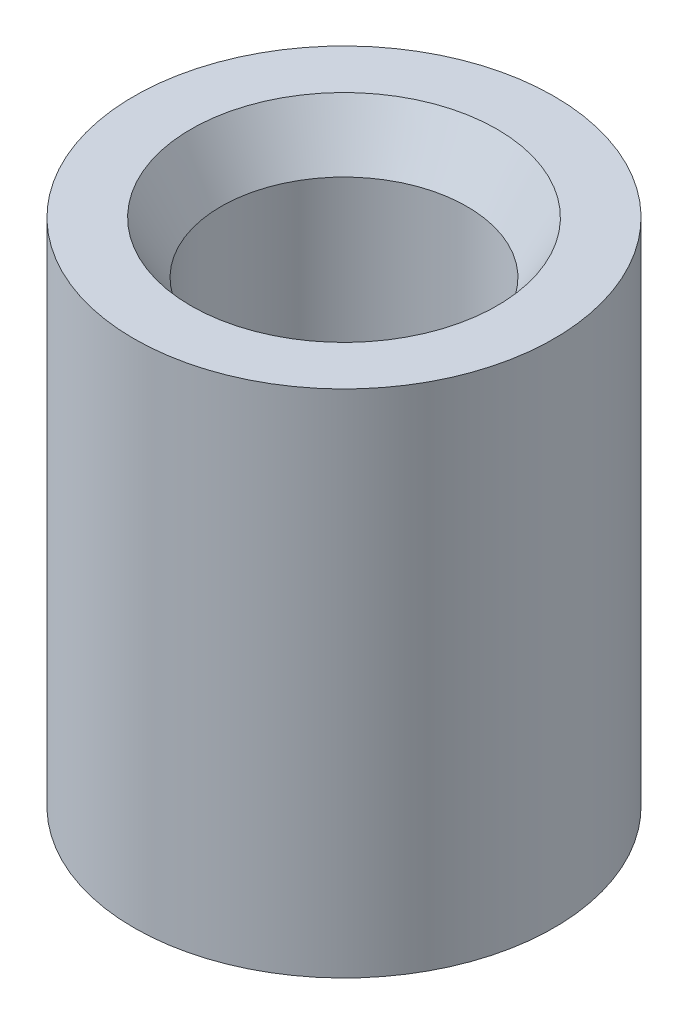
from build123d import *

# Parameters (mm, degrees)
SKETCH_1_R      = 7
SKETCH_1_R_2    = 4.1
EXTRUDE_1_DEPTH = 17
SKETCH_2_R      = 7
EXTRUDE_2_DEPTH = 10
CHAMFER_1_SIZE  = 1
CHAMFER_1_SIZE2 = 1.732050808


with BuildPart() as part:
    # Эскиз1 → Бобышка-Вытянуть1 (new body)
    with BuildSketch(Plane(origin=(0, 0, 0), x_dir=(1, 0, 0), z_dir=(0, 1, 0))):
        with Locations(Location((0, 0, 0), (0, 0, 270))):
            Circle(SKETCH_1_R)
        with Locations(Location((0, 0, 0), (0, 0, 270))):
            Circle(SKETCH_1_R_2, mode=Mode.SUBTRACT)
    extrude(amount=EXTRUDE_1_DEPTH)

    # Эскиз2 → Бобышка-Вытянуть2 (add)
    with BuildSketch(Plane.XZ):
        with Locations(Location((0, 0, 0), (0, 0, 90))):
            Circle(SKETCH_2_R)
    extrude(amount=-EXTRUDE_2_DEPTH)

    # Фаска1
    chamfer_1_edges = [part.edges().sort_by_distance(p)[0] for p in [
        (0, 17, -4.1),
    ]]
    chamfer_1_side = [part.faces().sort_by_distance(p)[0] for p in [
        (0, 17, -6.802010101),
    ]]
    chamfer(chamfer_1_edges, length=CHAMFER_1_SIZE, length2=CHAMFER_1_SIZE2, reference=chamfer_1_side[0])


solid = part.part
